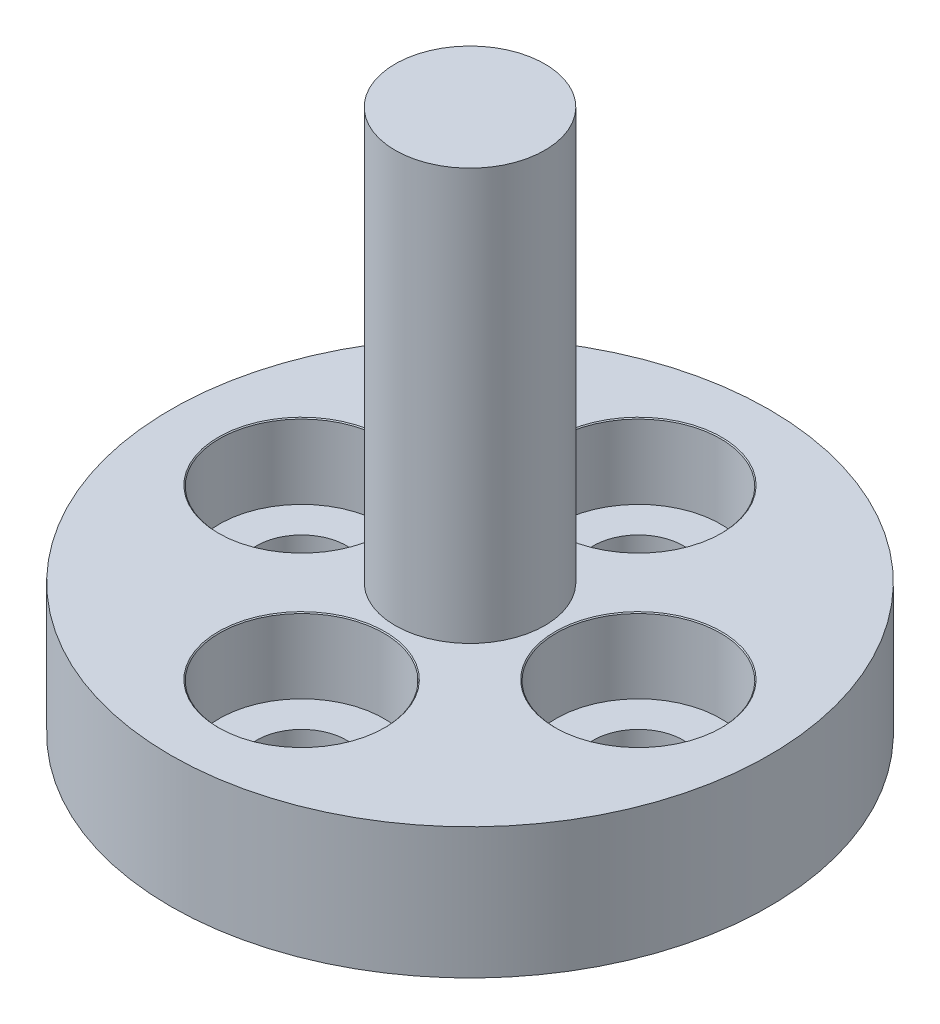
from build123d import *

# Parameters (mm, degrees)
CBORE_FOR_M2_SHCS1_AT_2_COUNT = 2
CBORE_FOR_M2_SHCS1_AT_2_PITCH = 6.363961031
CBORE_FOR_M2_SHCS1_AT_3_COUNT = 2
CBORE_FOR_M2_SHCS1_AT_3_PITCH = 9
CBORE_FOR_M2_SHCS1_AT_4_COUNT = 2
CBORE_FOR_M2_SHCS1_AT_4_PITCH = 6.363961031


with BuildPart() as part:
    # Sketch1 → Revolve1 (revolve)
    with BuildSketch(Plane.XY, mode=Mode.PRIVATE) as revolve1_sk:
        Polygon((0, 0), (8, 0), (8, 3.5), (2, 3.5), (2, 14.5), (0, 14.5), align=None)
    revolve(revolve1_sk.sketch.rotate(Axis((0, 14.5, 0), (0, -1, 0)), 90), axis=Axis((0, 14.5, 0), (0, -1, 0)))

    # Sketch5 → CBORE for M2 SHCS1 (revolve, cut)
    with BuildSketch(Plane(origin=(-4.5, 3.5, 0), x_dir=(0, 0, 1), z_dir=(1, 0, 0))):
        Polygon((0, 0), (0, 3.5), (1.2, 3.5), (1.2, 2), (2.2, 2), (2.2, 0.025), (2.225, 0), align=None)
    cbore_for_m2_shcs1 = revolve(axis=Axis((-4.5, 9.85, 0), (0, -1, 0)), mode=Mode.SUBTRACT)

    # CBORE for M2 SHCS1 at 2: CBORE for M2 SHCS1 ×2
    with Locations(*[Vector(0.7071067811865476, 0, -0.7071067811865476) * (i * CBORE_FOR_M2_SHCS1_AT_2_PITCH) for i in range(1, CBORE_FOR_M2_SHCS1_AT_2_COUNT)]):
        add(cbore_for_m2_shcs1, mode=Mode.SUBTRACT)

    # CBORE for M2 SHCS1 at 3: CBORE for M2 SHCS1 ×2
    with Locations(*[(i * CBORE_FOR_M2_SHCS1_AT_3_PITCH, 0, 0) for i in range(1, CBORE_FOR_M2_SHCS1_AT_3_COUNT)]):
        add(cbore_for_m2_shcs1, mode=Mode.SUBTRACT)

    # CBORE for M2 SHCS1 at 4: CBORE for M2 SHCS1 ×2
    with Locations(*[Vector(0.7071067811865476, 0, 0.7071067811865476) * (i * CBORE_FOR_M2_SHCS1_AT_4_PITCH) for i in range(1, CBORE_FOR_M2_SHCS1_AT_4_COUNT)]):
        add(cbore_for_m2_shcs1, mode=Mode.SUBTRACT)


solid = part.part
